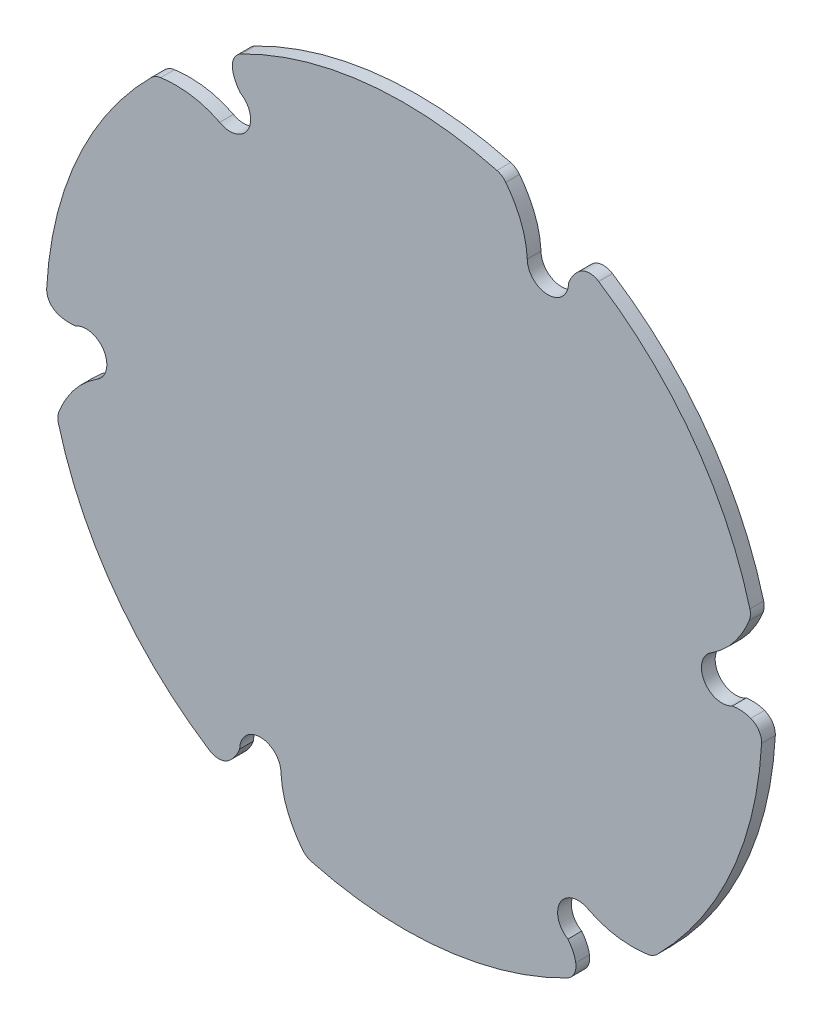
from build123d import *

# Parameters (mm, degrees)
SKETCH1_R           = 165.1
BOSS_EXTRUDE1_DEPTH = 3.175
CUT_EXTRUDE1_DEPTH  = 234.572991803
CIRPATTERN1_COUNT   = 6
FILLET1_R           = 7.62


with BuildPart() as part:
    # Sketch1 → Boss-Extrude1 (new, symmetric)
    with BuildSketch(Plane.XY):
        Circle(SKETCH1_R)
    extrude(amount=BOSS_EXTRUDE1_DEPTH, both=True)

    # Sketch2 → Cut-Extrude1 (cut, through all)
    with BuildSketch(Plane.XY.offset(3.175)):
        with BuildLine():
            ThreePointArc((-56.8071, -131.064), (-66.3321, -121.539), (-75.8571, -131.064))
            add(Edge.make_bspline(
                [(-75.8571, -131.064), (-78.753450449, -138.429499147), (-85.971521231, -140.950017869)],
                knots=[0, 0, 0, 1, 1, 1], degree=2))
            ThreePointArc((-85.971521231, -140.950017869), (-66.21496115, -151.240169664), (-45.253014014, -158.777122794))
            add(Edge.make_bspline(
                [(-56.8071, -131.064), (-56.098700423, -145.821305076), (-45.253014014, -158.777122794)],
                knots=[0, 0, 0, 1, 1, 1], degree=2))
        make_face()
    cut_extrude1 = extrude(amount=-CUT_EXTRUDE1_DEPTH, mode=Mode.SUBTRACT)

    # CirPattern1: Cut-Extrude1 ×6 about axis
    cirpattern1_axis = Axis((0, 0, 0), (0, 0, 1))
    for i in range(1, CIRPATTERN1_COUNT):
        add(cut_extrude1.rotate(cirpattern1_axis, i * 360 / CIRPATTERN1_COUNT), mode=Mode.SUBTRACT)

    # Fillet1
    fillet1_edges = [part.edges().sort_by_distance(p)[0] for p in [
        (-45.253014014, -158.777122794, 0),
        (-85.971521231, -140.950017869, 0),
        (114.878514872, -118.578821131, 0),
        (79.080535523, -144.928530323, 0),
        (160.131528886, 40.198301663, 0),
        (165.052056754, -3.978512454, 0),
        (45.253014014, 158.777122794, 0),
        (85.971521231, 140.950017869, 0),
        (-114.878514872, 118.578821131, 0),
        (-79.080535523, 144.928530323, 0),
        (-160.131528886, -40.198301663, 0),
        (-165.052056754, 3.978512454, 0),
    ]]
    fillet(fillet1_edges, radius=FILLET1_R)


solid = part.part
